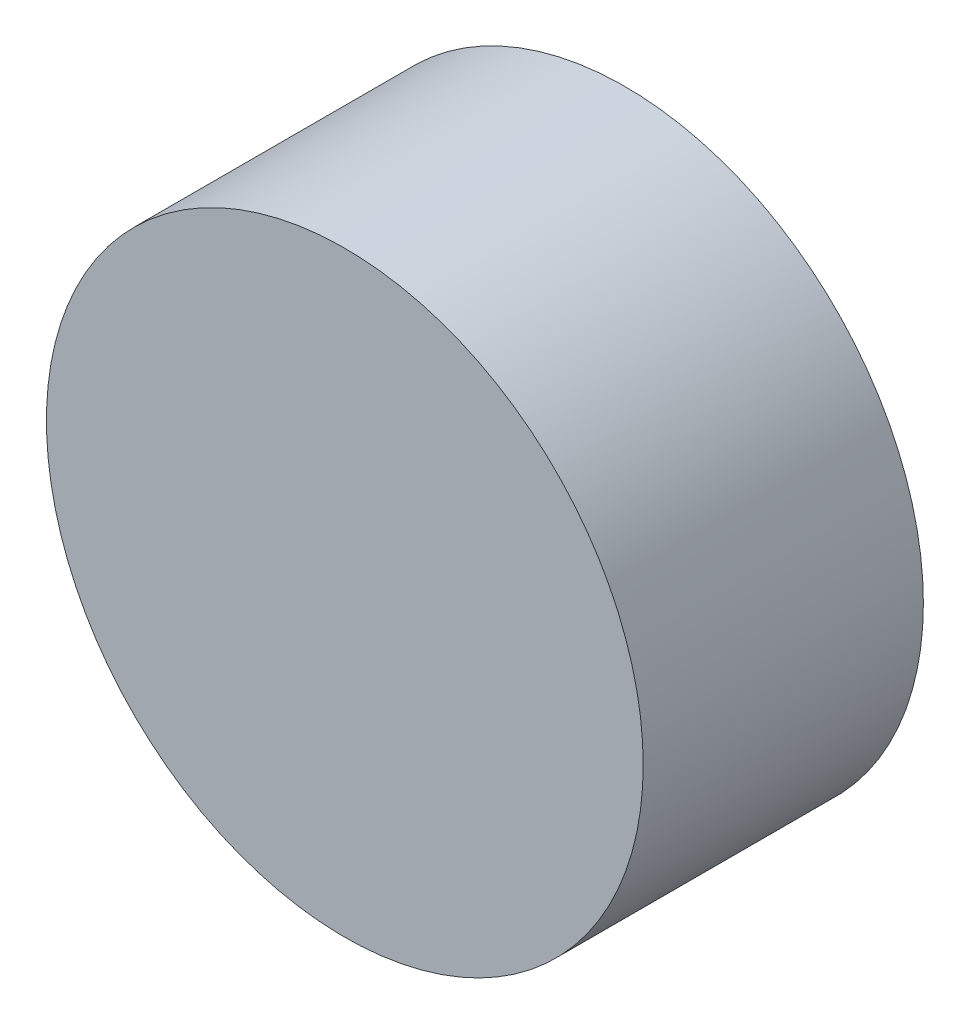
from build123d import *

# Parameters (mm, degrees)
SKETCH1_R           = 45
BOSS_EXTRUDE1_DEPTH = 48.75
SKETCH1_3_R         = 45
SKETCH1_3_R_2       = 31.5
CUT_EXTRUDE1_DEPTH  = 6.5
SKETCH1_4_R         = 15.75
SKETCH1_4_R_2       = 2.5
CUT_EXTRUDE2_DEPTH  = 6.2


with BuildPart() as part:
    # Sketch1 → Boss-Extrude1 (new body)
    with BuildSketch(Plane.XY):
        Circle(SKETCH1_R)
    extrude(amount=BOSS_EXTRUDE1_DEPTH)

    # Sketch1<3> → Cut-Extrude1 (cut)
    with BuildSketch(Plane.XY):
        Circle(SKETCH1_3_R)
        Circle(SKETCH1_3_R_2, mode=Mode.SUBTRACT)
    extrude(amount=CUT_EXTRUDE1_DEPTH, mode=Mode.SUBTRACT)

    # Sketch1<4> → Cut-Extrude2 (cut)
    with BuildSketch(Plane.XY):
        Circle(SKETCH1_4_R)
        with Locations((17.67766953, 17.67766953)):
            Circle(SKETCH1_4_R_2)
        with Locations((17.67766953, -17.67766953)):
            Circle(SKETCH1_4_R_2)
        with Locations((-17.67766953, -17.67766953)):
            Circle(SKETCH1_4_R_2)
        with Locations((-17.67766953, 17.67766953)):
            Circle(SKETCH1_4_R_2)
    extrude(amount=CUT_EXTRUDE2_DEPTH, mode=Mode.SUBTRACT)


solid = part.part
